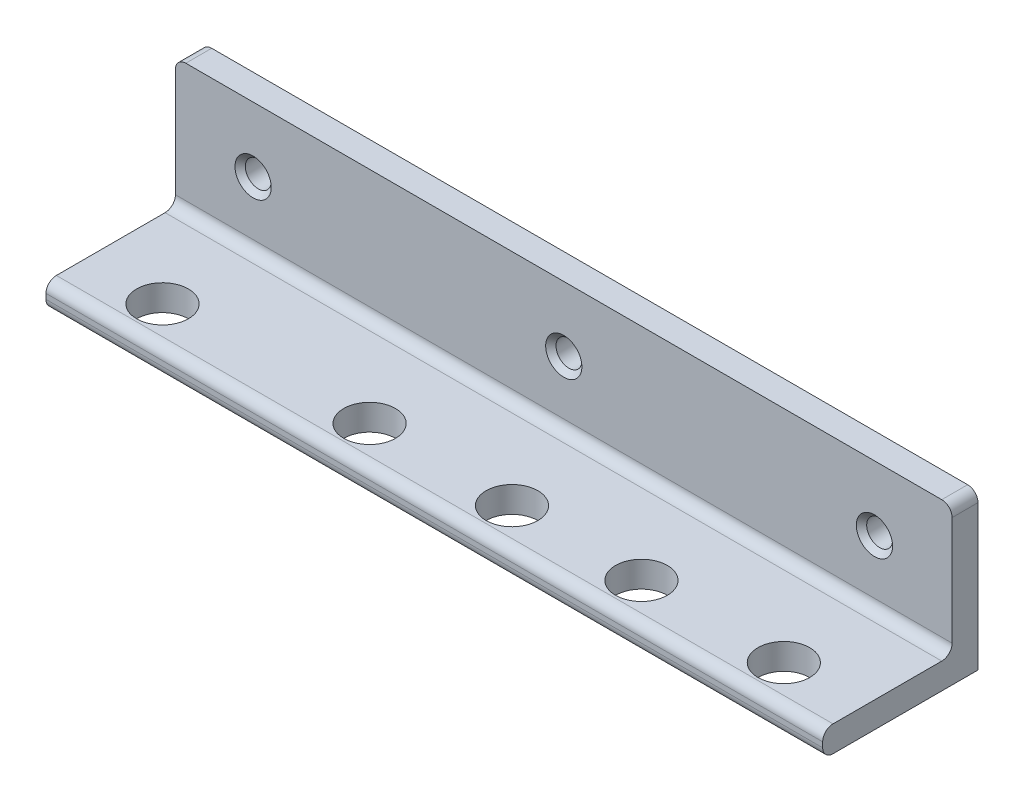
from build123d import *

# Parameters (mm, degrees)
SKETCH1_W           = 150
SKETCH1_H           = 30
BOSS_EXTRUDE1_DEPTH = 5
SKETCH3_W           = 150
SKETCH3_H           = 5
BOSS_EXTRUDE2_DEPTH = 25
SKETCH6_R           = 5
CUT_EXTRUDE2_DEPTH  = 25
SKETCH7_R           = 2.5
CUT_EXTRUDE3_DEPTH  = 25
CHAMFER1_SIZE       = 1
FILLET2_R           = 2


with BuildPart() as part:
    # Sketch1 → Boss-Extrude1 (new body)
    with BuildSketch(Plane(origin=(0, 0, 0), x_dir=(1, 0, 0), z_dir=(0, 1, 0))):
        with Locations((22.308802864, -0.815715524)):
            Rectangle(SKETCH1_W, SKETCH1_H)
    extrude(amount=BOSS_EXTRUDE1_DEPTH)

    # Sketch3 → Boss-Extrude2 (add)
    with BuildSketch(Plane(origin=(0, 5, 0), x_dir=(1, 0, 0), z_dir=(0, 1, 0))):
        with Locations((22.308802864, 11.684284476)):
            Rectangle(SKETCH3_W, SKETCH3_H)
    extrude(amount=BOSS_EXTRUDE2_DEPTH)

    # Sketch6 → Cut-Extrude2 (cut)
    with BuildSketch(Plane(origin=(0, 5, 0), x_dir=(1, 0, 0), z_dir=(0, 1, 0))):
        with Locations(Location((82.308802864, -8.315715524, 0), (0, 0, 90))):
            Circle(SKETCH6_R)
        with Locations(Location((54.808802864, -8.315715524, 0), (0, 0, 90))):
            Circle(SKETCH6_R)
        with Locations(Location((29.808802864, -8.315715524, 0), (0, 0, 90))):
            Circle(SKETCH6_R)
        with Locations(Location((2.308802864, -8.315715524, 0), (0, 0, 90))):
            Circle(SKETCH6_R)
        with Locations(Location((-37.691197136, -8.315715524, 0), (0, 0, 90))):
            Circle(SKETCH6_R)
    extrude(amount=-CUT_EXTRUDE2_DEPTH, mode=Mode.SUBTRACT)

    # Sketch7 → Cut-Extrude3 (cut)
    with BuildSketch(Plane.XY.offset(-9.184284476)):
        with Locations((82.308802864, 17.478664245)):
            Circle(SKETCH7_R)
        with Locations((-37.691197136, 17.478664245)):
            Circle(SKETCH7_R)
        with Locations((22.308802864, 17.478664245)):
            Circle(SKETCH7_R)
    extrude(amount=-CUT_EXTRUDE3_DEPTH, mode=Mode.SUBTRACT)

    # Chamfer1
    chamfer1_edges = [part.edges().sort_by_distance(p)[0] for p in [
        (79.808802864, 17.478664245, -9.184284476),
        (-40.191197136, 17.478664245, -9.184284476),
        (19.808802864, 17.478664245, -9.184284476),
    ]]
    chamfer(chamfer1_edges, length=CHAMFER1_SIZE)

    # Fillet2
    fillet2_edges = [part.edges().sort_by_distance(p)[0] for p in [
        (22.308802864, 5, 15.815715524),
        (22.308802864, 0, 15.815715524),
        (22.308802864, 5, -9.184284476),
        (-52.691197136, 30, -11.684284476),
        (97.308802864, 30, -11.684284476),
    ]]
    fillet(fillet2_edges, radius=FILLET2_R)


solid = part.part
